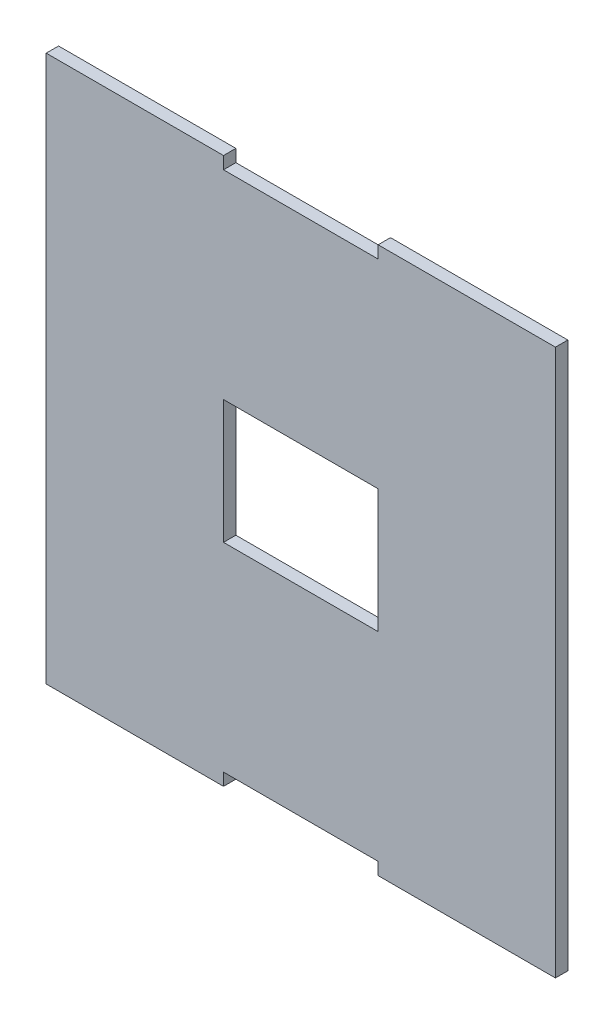
from build123d import *

# Parameters (mm, degrees)
ESBO_O1_W                = 75
ESBO_O1_H                = 60
RESSALTO_EXTRUS_O1_DEPTH = 6


with BuildPart() as part:
    # Esboço1 → Ressalto-extrusão1 (new body)
    with BuildSketch(Plane.XY):
        Polygon((161, 0), (247, 0), (247, 265), (161, 265), (161, 259), (86, 259), (86, 265), (0, 265), (0, 0), (86, 0), (86, 6), (161, 6), align=None)
        with Locations((123.5, 132.5)):
            Rectangle(ESBO_O1_W, ESBO_O1_H, mode=Mode.SUBTRACT)
    extrude(amount=RESSALTO_EXTRUS_O1_DEPTH)


solid = part.part
